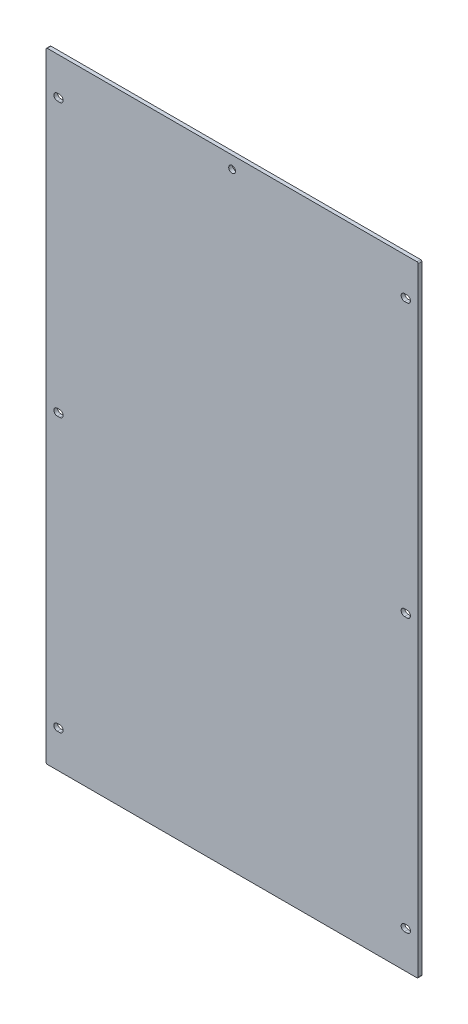
from build123d import *

# Parameters (mm, degrees)
SKETCH1_W           = 300
SKETCH1_H           = 500
BOSS_EXTRUDE1_DEPTH = 3
SKETCH2_R           = 2.75
CUT_EXTRUDE1_DEPTH  = 10
FILLET1_R           = 1


with BuildPart() as part:
    # Sketch1 → Boss-Extrude1 (new body)
    with BuildSketch(Plane.XY):
        Rectangle(SKETCH1_W, SKETCH1_H)
    extrude(amount=BOSS_EXTRUDE1_DEPTH)

    # Sketch2 → Cut-Extrude1 (cut)
    with BuildSketch(Plane.XY.offset(3)):
        with Locations((0, 240)):
            Circle(SKETCH2_R)
        with BuildLine():
            Line((-141, -217.25), (-139, -217.25))
            ThreePointArc((-139, -217.25), (-136.25, -220), (-139, -222.75))
            Line((-139, -222.75), (-141, -222.75))
            ThreePointArc((-141, -222.75), (-143.75, -220), (-141, -217.25))
        make_face()
        with BuildLine():
            Line((-141, 222.75), (-139, 222.75))
            ThreePointArc((-139, 222.75), (-136.25, 220), (-139, 217.25))
            Line((-139, 217.25), (-141, 217.25))
            ThreePointArc((-141, 217.25), (-143.75, 220), (-141, 222.75))
        make_face()
        with BuildLine():
            Line((-141, 2.75), (-139, 2.75))
            ThreePointArc((-139, 2.75), (-136.25, 0), (-139, -2.75))
            Line((-139, -2.75), (-141, -2.75))
            ThreePointArc((-141, -2.75), (-143.75, 0), (-141, 2.75))
        make_face()
    cut_extrude1 = extrude(amount=-CUT_EXTRUDE1_DEPTH, mode=Mode.SUBTRACT)

    # Mirror1: Cut-Extrude1 across plane
    add(cut_extrude1.mirror(Plane(origin=(0, 0, 0), x_dir=(0, 0, 1), z_dir=(1, 0, 0))), mode=Mode.SUBTRACT)

    # Fillet1
    fillet1_edges = [part.edges().sort_by_distance(p)[0] for p in [
        (-150, 250, 1.5),
        (150, 250, 1.5),
        (150, -250, 1.5),
        (-150, -250, 1.5),
    ]]
    fillet(fillet1_edges, radius=FILLET1_R)


solid = part.part
